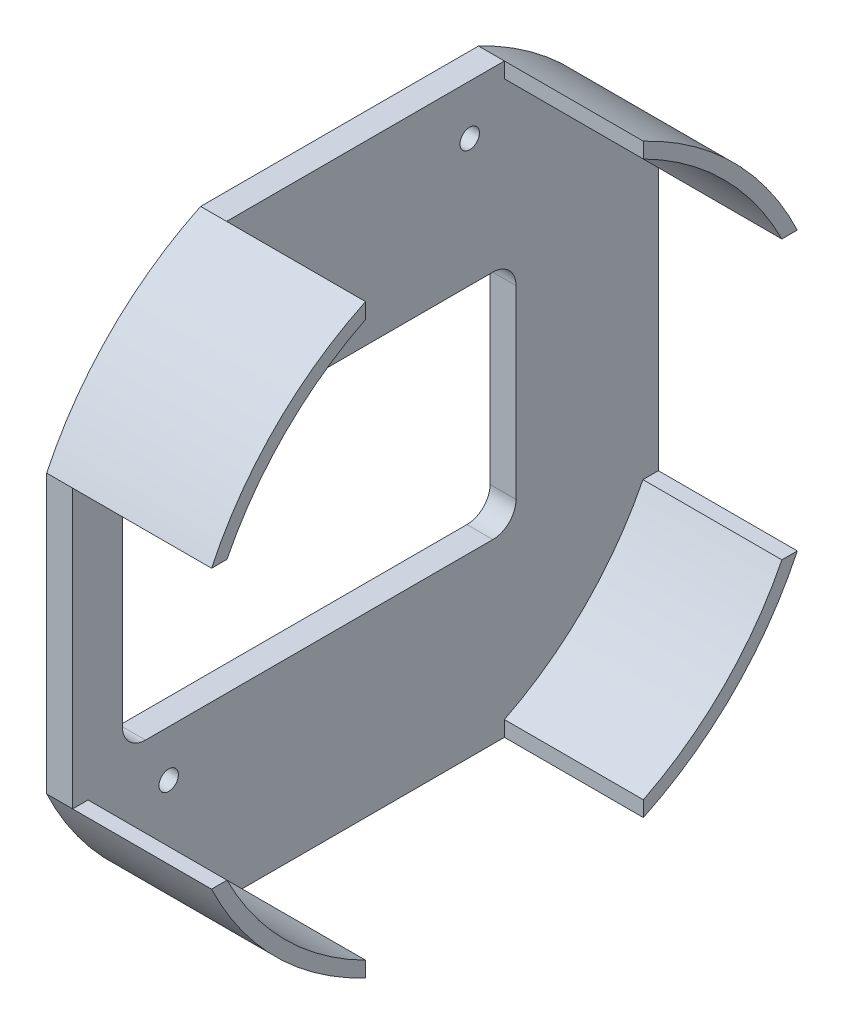
from build123d import *
from build123d.topology import SkipClean

# Parameters (mm, degrees)
SKETCH_1_R          = 70
SKETCH_1_R_2        = 2.1
SKETCH_1_W          = 85
SKETCH_1_H          = 50
EXTRUDE_2_DEPTH     = 5.6
EXTRUDE_3_DEPTH     = 30
CUT_EXTRUDE_1_DEPTH = 111.453610172
FILLET_1_R          = 5


with BuildPart() as part:
    # ｽｹｯﾁ1 → ﾎﾞｽ - 押し出し2 (new body)
    with BuildSketch(Plane(origin=(0, 0, 0), x_dir=(0, 0, -1), z_dir=(1, 0, 0))):
        with Locations((10, 0)):
            Circle(SKETCH_1_R)
        with Locations(Location((32.5, 52.5, 0), (0, 0, 180))):
            Circle(SKETCH_1_R_2, mode=Mode.SUBTRACT)
        with Locations((-32.5, -35)):
            Circle(SKETCH_1_R_2, mode=Mode.SUBTRACT)
        Rectangle(SKETCH_1_W, SKETCH_1_H, mode=Mode.SUBTRACT)
    extrude(amount=EXTRUDE_2_DEPTH)

    # ｽｹｯﾁ2 → ﾎﾞｽ - 押し出し3 (add)
    with SkipClean():  # the faces are left unmerged after this step: merging them gives an invalid solid
        with BuildSketch(Plane(origin=(5.6, 0, 0), x_dir=(0, 0, -1), z_dir=(1, 0, 0))):
            with BuildLine():
                Line((-53.245553203, 30), (-49.908263203, 30))
                ThreePointArc((-49.908263203, 30), (-37.376154339, 47.376154339), (-20, 59.908263203))
                Line((-20, 59.908263203), (-20, 63.245553203))
                ThreePointArc((-20, 63.245553203), (-39.497474683, 49.497474683), (-53.245553203, 30))
            make_face()
            with BuildLine():
                Line((-53.245553203, -30), (-49.908263203, -30))
                ThreePointArc((-49.908263203, -30), (-37.376154339, -47.376154339), (-20, -59.908263203))
                Line((-20, -59.908263203), (-20, -63.245553203))
                ThreePointArc((-20, -63.245553203), (-39.497474683, -49.497474683), (-53.245553203, -30))
            make_face()
            with BuildLine():
                Line((40, 63.245553203), (40, 59.908263203))
                ThreePointArc((40, 59.908263203), (57.376154339, 47.376154339), (69.908263203, 30))
                Line((69.908263203, 30), (73.245553203, 30))
                ThreePointArc((73.245553203, 30), (59.497474683, 49.497474683), (40, 63.245553203))
            make_face()
            with BuildLine():
                Line((69.908263203, -30), (73.245553203, -30))
                ThreePointArc((73.245553203, -30), (59.497474683, -49.497474683), (40, -63.245553203))
                Line((40, -63.245553203), (40, -59.908263203))
                ThreePointArc((40, -59.908263203), (57.376154339, -47.376154339), (69.908263203, -30))
            make_face()
        extrude(amount=EXTRUDE_3_DEPTH)

    # ｽｹｯﾁ3 → ｶｯﾄ - 押し出し1 (cut, through all)
    with BuildSketch(Plane(origin=(5.6, 0, 0), x_dir=(0, 0, -1), z_dir=(1, 0, 0))):
        with BuildLine():
            Line((-20, 63.245553203), (40, 63.245553203))
            ThreePointArc((40, 63.245553203), (10, 70), (-20, 63.245553203))
        make_face()
        with BuildLine():
            Line((-53.245553203, -30), (-53.245553203, 30))
            ThreePointArc((-53.245553203, 30), (-60, 0), (-53.245553203, -30))
        make_face()
        with BuildLine():
            Line((40, -63.245553203), (-20, -63.245553203))
            ThreePointArc((-20, -63.245553203), (10, -70), (40, -63.245553203))
        make_face()
        with BuildLine():
            Line((73.245553203, 30), (73.245553203, -30))
            ThreePointArc((73.245553203, -30), (80, 0), (73.245553203, 30))
        make_face()
    extrude(amount=-CUT_EXTRUDE_1_DEPTH, mode=Mode.SUBTRACT)

    # ﾌｨﾚｯﾄ1
    fillet_1_edges = [part.edges().sort_by_distance(p)[0] for p in [
        (2.8, -25, -42.5),
        (2.8, 25, -42.5),
        (2.8, 25, 42.5),
        (2.8, -25, 42.5),
    ]]
    fillet(fillet_1_edges, radius=FILLET_1_R)


solid = part.part
